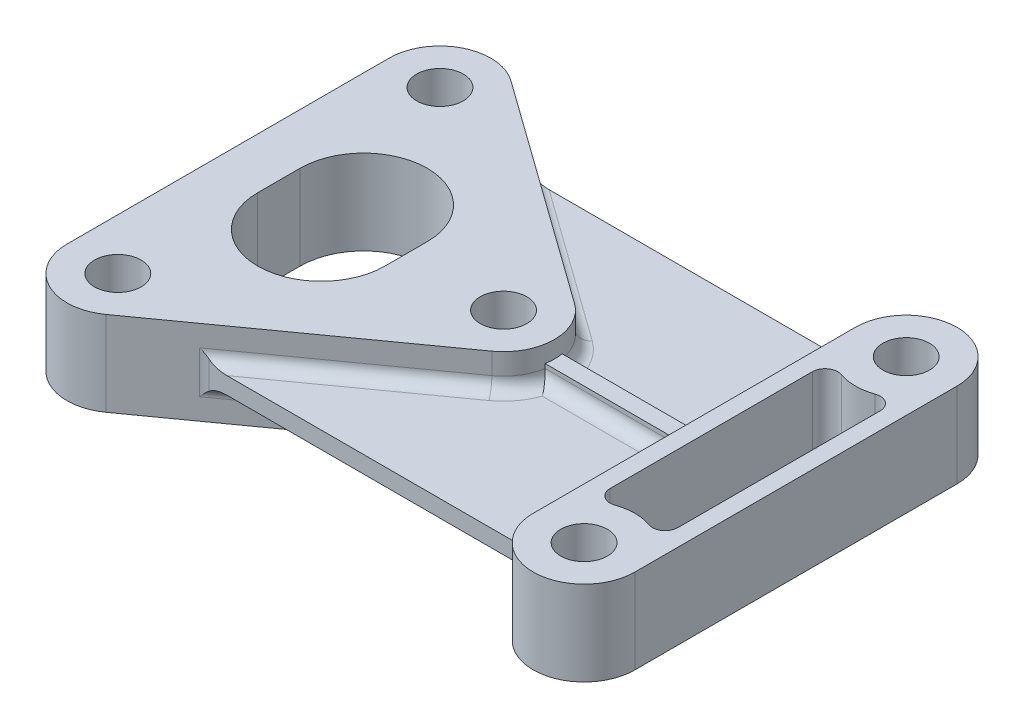
from build123d import *

# Parameters (mm, degrees)
SKETCH1_R             = 5.5
BOSS_EXTRUDE1_DEPTH   = 10
BOSS_EXTRUDE1_2_DEPTH = 10
BOSS_EXTRUDE2_DEPTH   = 2
BOSS_EXTRUDE3_START   = 4
BOSS_EXTRUDE3_DEPTH   = 4
CUT_EXTRUDE1_DEPTH    = 145.416065588
FILLET1_R             = 3
FILLET2_R             = 3
CUT_EXTRUDE2_DEPTH    = 145.416065588


with BuildPart() as part:
    # Sketch1 → Boss-Extrude1 (new, symmetric)
    with BuildSketch(Plane(origin=(0, 0, 0), x_dir=(1, 0, 0), z_dir=(0, 1, 0))):
        with BuildLine():
            Line((0, 38), (0, -38))
            ThreePointArc((0, -38), (6.518533014, -48.67490139), (18.99225328, -47.752353258))
            Line((18.99225328, -47.752353258), (71.99225328, -9.752353258))
            ThreePointArc((71.99225328, -9.752353258), (77, 0), (71.99225328, 9.752353258))
            Line((71.99225328, 9.752353258), (18.99225328, 47.752353258))
            ThreePointArc((18.99225328, 47.752353258), (6.518533014, 48.67490139), (0, 38))
        make_face()
        with Locations(Location((12, 38, 0), (0, 0, 270))):
            Circle(SKETCH1_R, mode=Mode.SUBTRACT)
        with Locations(Location((12, -38, 0), (0, 0, 270))):
            Circle(SKETCH1_R, mode=Mode.SUBTRACT)
        with Locations(Location((65, 0, 0), (0, 0, 270))):
            Circle(SKETCH1_R, mode=Mode.SUBTRACT)
    extrude(amount=BOSS_EXTRUDE1_DEPTH, both=True)



with BuildPart() as body_2:
    # Sketch1 → Boss-Extrude1 2 (new, symmetric)
    with BuildSketch(Plane(origin=(0, 0, 0), x_dir=(1, 0, 0), z_dir=(0, 1, 0))):
        with BuildLine():
            Line((134, 38), (134, -38))
            ThreePointArc((134, -38), (122, -50), (110, -38))
            Line((110, -38), (110, 38))
            ThreePointArc((110, 38), (122, 50), (134, 38))
        make_face()
        with Locations(Location((122, 38, 0), (0, 0, 270))):
            Circle(SKETCH1_R, mode=Mode.SUBTRACT)
        with Locations(Location((122, -38, 0), (0, 0, 270))):
            Circle(SKETCH1_R, mode=Mode.SUBTRACT)
    extrude(amount=BOSS_EXTRUDE1_2_DEPTH, both=True)


with BuildPart() as part_1:
    add(part.part)

    add(body_2.part)  # Boss-Extrude2 merges body 2
    # Sketch2 → Boss-Extrude2 (add, symmetric)
    with BuildSketch(Plane(origin=(0, 0, 0), x_dir=(1, 0, 0), z_dir=(0, 1, 0))):
        with BuildLine():
            Line((110, 38), (110, -38))
            Line((110, -38), (32.594219666, -38))
            Line((32.594219666, -38), (71.99225328, -9.752353258))
            ThreePointArc((71.99225328, -9.752353258), (77, 0), (71.99225328, 9.752353258))
            Line((71.99225328, 9.752353258), (32.594219666, 38))
            Line((32.594219666, 38), (110, 38))
        make_face()
    extrude(amount=BOSS_EXTRUDE2_DEPTH, both=True)

    # Sketch3 → Boss-Extrude3 (add)
    with BuildSketch(Plane(origin=(0, 2, 0), x_dir=(1, 0, 0), z_dir=(0, 1, 0)).offset(BOSS_EXTRUDE3_START)):
        with BuildLine():
            Line((76.832159566, 2), (110, 2))
            Line((110, 2), (110, -2))
            Line((110, -2), (76.832159566, -2))
            ThreePointArc((76.832159566, -2), (77, 0), (76.832159566, 2))
        make_face()
    extrude(amount=-BOSS_EXTRUDE3_DEPTH)

    # Sketch4 → Cut-Extrude1 (cut, through all)
    with BuildSketch(Plane(origin=(0, 10, 0), x_dir=(1, 0, 0), z_dir=(0, 1, 0))):
        with BuildLine():
            Line((114, 29.05572809), (114, -29.05572809))
            ThreePointArc((114, -29.05572809), (122, -26), (130, -29.05572809))
            Line((130, -29.05572809), (130, 29.05572809))
            ThreePointArc((130, 29.05572809), (122, 26), (114, 29.05572809))
        make_face()
    extrude(amount=-CUT_EXTRUDE1_DEPTH, mode=Mode.SUBTRACT)

    # Fillet1
    fillet1_edges = [part_1.edges().sort_by_distance(p)[0] for p in [
        (114, 0, -29.05572809),
        (130, 0, -29.05572809),
        (130, 0, 29.05572809),
        (114, 0, 29.05572809),
    ]]
    fillet(fillet1_edges, radius=FILLET1_R)

    # Fillet2
    fillet2_edges = [part_1.edges().sort_by_distance(p)[0] for p in [
        (52.293236473, -2, -23.876176629),
        (77, -2, 0),
        (52.293236473, -2, 23.876176629),
        (32.594219666, 0, 38),
        (52.293236473, 2, -23.876176629),
        (75.179114648, 2, -6.354968528),
        (52.293236473, 2, 23.876176629),
        (75.179114648, 2, 6.354968528),
        (93.416079783, 2, 2),
        (93.416079783, 2, -2),
    ]]
    fillet(fillet2_edges, radius=FILLET2_R)

    # Sketch5 → Cut-Extrude2 (cut, through all)
    with BuildSketch(Plane(origin=(0, 10, 0), x_dir=(1, 0, 0), z_dir=(0, 1, 0))):
        with BuildLine():
            Line((41.999381369, 5.001855509), (42.000618401, -4.998144414))
            ThreePointArc((42.000618401, -4.998144414), (27.002474063, -19.999999847), (12.000618631, -5.001855509))
            Line((12.000618631, -5.001855509), (11.999381599, 4.998144414))
            ThreePointArc((11.999381599, 4.998144414), (26.997525937, 19.999999847), (41.999381369, 5.001855509))
        make_face()
    extrude(amount=-CUT_EXTRUDE2_DEPTH, mode=Mode.SUBTRACT)


solid = part_1.part
